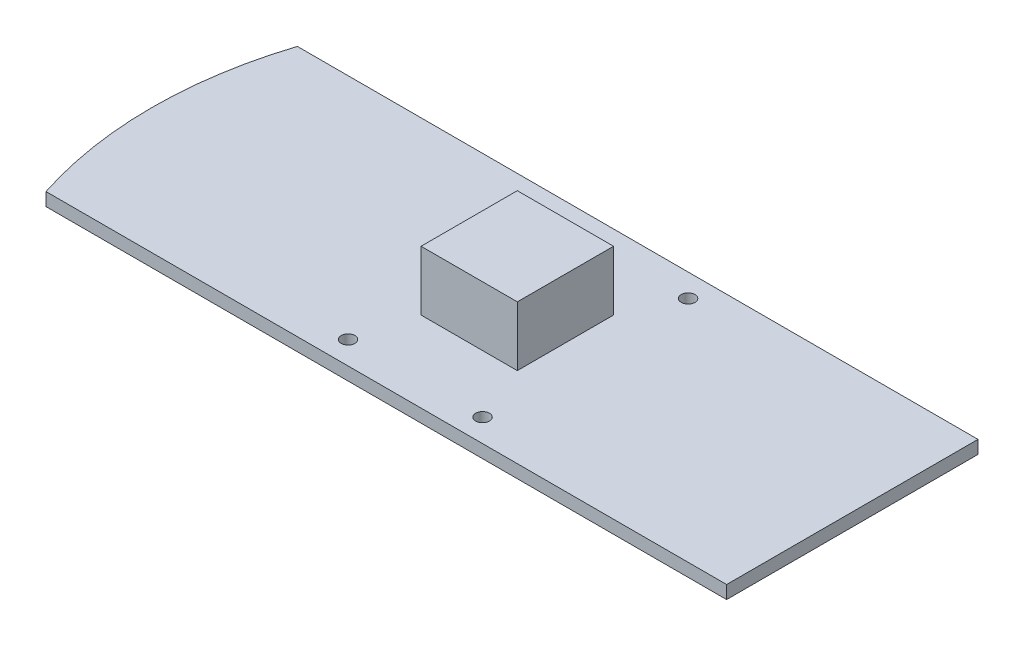
from build123d import *

# Parameters (mm, degrees)
SKETCH1_W           = 148.5
SKETCH1_H           = 54.85
SKETCH1_R           = 1.5
BOSS_EXTRUDE1_DEPTH = 2.85
SKETCH2_W           = 21
SKETCH2_H           = 21
BOSS_EXTRUDE2_DEPTH = 13


with BuildPart() as part:
    # Sketch1 → Boss-Extrude1 (new body)
    # profile 1 of 2: a face of its own
    with BuildSketch(Plane(origin=(0, 0, 0), x_dir=(1, 0, 0), z_dir=(0, 1, 0))):
        with Locations((74.25, -27.425)):
            Rectangle(SKETCH1_W, SKETCH1_H)
        with Locations(Location((90.25, -5, 0), (0, 0, 270))):
            Circle(SKETCH1_R, mode=Mode.SUBTRACT)
        with Locations(Location((60.9, -5, 0), (0, 0, 270))):
            Circle(SKETCH1_R, mode=Mode.SUBTRACT)
        with Locations(Location((60.9, -49.85, 0), (0, 0, 270))):
            Circle(SKETCH1_R, mode=Mode.SUBTRACT)
        with Locations(Location((90.25, -49.85, 0), (0, 0, 270))):
            Circle(SKETCH1_R, mode=Mode.SUBTRACT)
    # profile 2 of 2: a face of its own
    with BuildSketch(Plane(origin=(0, 0, 0), x_dir=(1, 0, 0), z_dir=(0, 1, 0))):
        with BuildLine():
            Line((0, 0), (0, -54.85))
            ThreePointArc((0, -54.85), (-4.330823938, -27.425), (0, 0))
        make_face()
    extrude(amount=BOSS_EXTRUDE1_DEPTH)

    # Sketch2 → Boss-Extrude2 (add)
    with BuildSketch(Plane(origin=(0, 2.85, 0), x_dir=(1, 0, 0), z_dir=(0, 1, 0))):
        with Locations((74.75319094, -26.769521426)):
            Rectangle(SKETCH2_W, SKETCH2_H)
    extrude(amount=BOSS_EXTRUDE2_DEPTH)


solid = part.part
